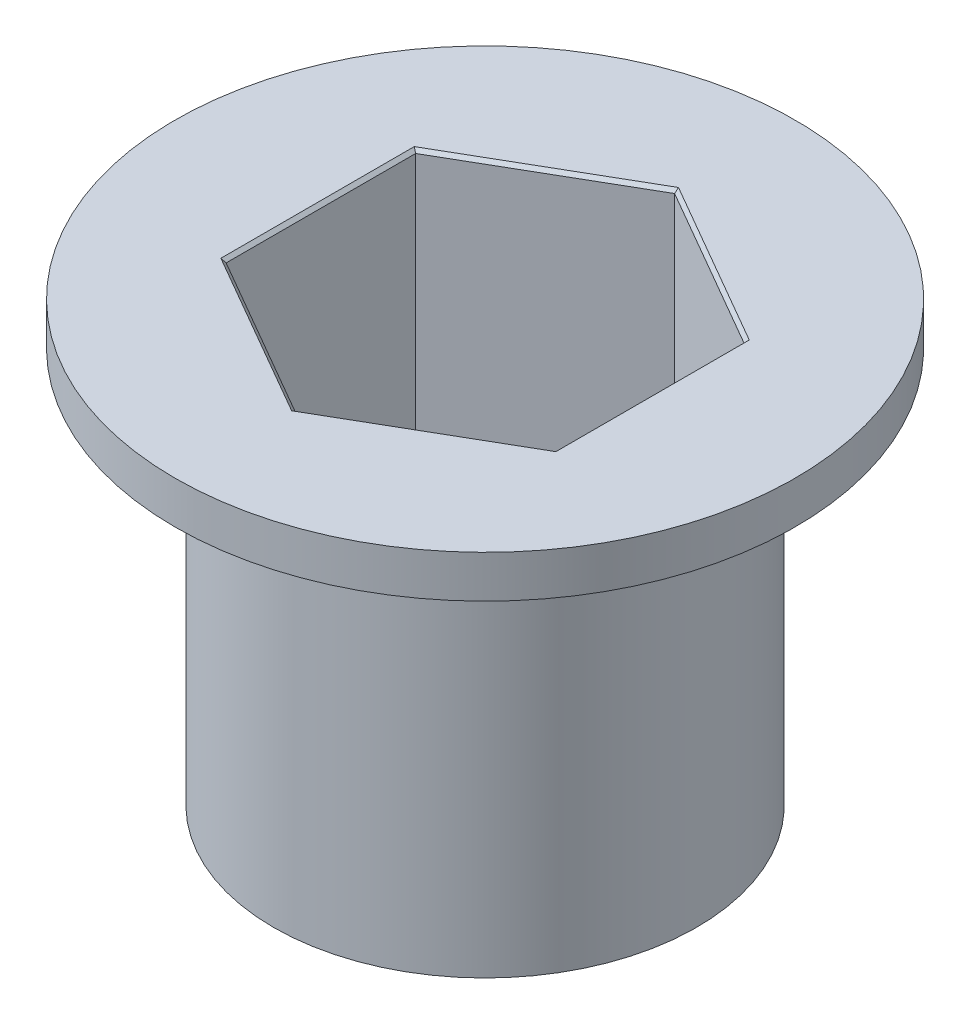
from build123d import *

# Parameters (mm, degrees)
SKETCH1_R           = 6.35
BOSS_EXTRUDE1_DEPTH = 11.8872
SKETCH2_R           = 9.308550363
BOSS_EXTRUDE2_DEPTH = 1.27
CHAMFER1_SIZE       = 0.1
CHAMFER2_SIZE       = 0.1


with BuildPart() as part:
    # Sketch1 → Boss-Extrude1 (new body)
    with BuildSketch(Plane(origin=(0, 0, 0), x_dir=(1, 0, 0), z_dir=(0, 1, 0))):
        with Locations(Location((0, 0, 0), (0, 0, 270))):
            Circle(SKETCH1_R)
        Polygon((0, 5.689786881), (-4.927499981, 2.84489344), (-4.927499981, -2.84489344), (0, -5.689786881), (4.927499981, -2.84489344), (4.927499981, 2.84489344), align=None, mode=Mode.SUBTRACT)
    extrude(amount=BOSS_EXTRUDE1_DEPTH)

    # Sketch2 → Boss-Extrude2 (add)
    with BuildSketch(Plane(origin=(0, 11.8872, 0), x_dir=(1, 0, 0), z_dir=(0, 1, 0))):
        with Locations(Location((0, 0, 0), (0, 0, 270))):
            Circle(SKETCH2_R)
        Polygon((0, 5.689786881), (-4.927499981, 2.84489344), (-4.927499981, -2.84489344), (0, -5.689786881), (4.927499981, -2.84489344), (4.927499981, 2.84489344), align=None, mode=Mode.SUBTRACT)
    extrude(amount=BOSS_EXTRUDE2_DEPTH)

    # Chamfer1
    chamfer1_edges = [part.edges().sort_by_distance(p)[0] for p in [
        (-4.927499981, 0, 0),
        (-2.46374999, 0, 4.267340161),
        (2.463749991, 0, 4.267340161),
        (4.927499981, 0, 0),
        (2.46374999, 0, -4.267340161),
        (-2.463749991, 0, -4.267340161),
    ]]
    chamfer(chamfer1_edges, length=CHAMFER1_SIZE)

    # Chamfer2
    chamfer2_edges = [part.edges().sort_by_distance(p)[0] for p in [
        (2.46374999, 13.1572, -4.267340161),
        (-2.463749991, 13.1572, -4.267340161),
        (-4.927499981, 13.1572, 0),
        (-2.46374999, 13.1572, 4.267340161),
        (2.463749991, 13.1572, 4.267340161),
        (4.927499981, 13.1572, 0),
    ]]
    chamfer(chamfer2_edges, length=CHAMFER2_SIZE)


solid = part.part
